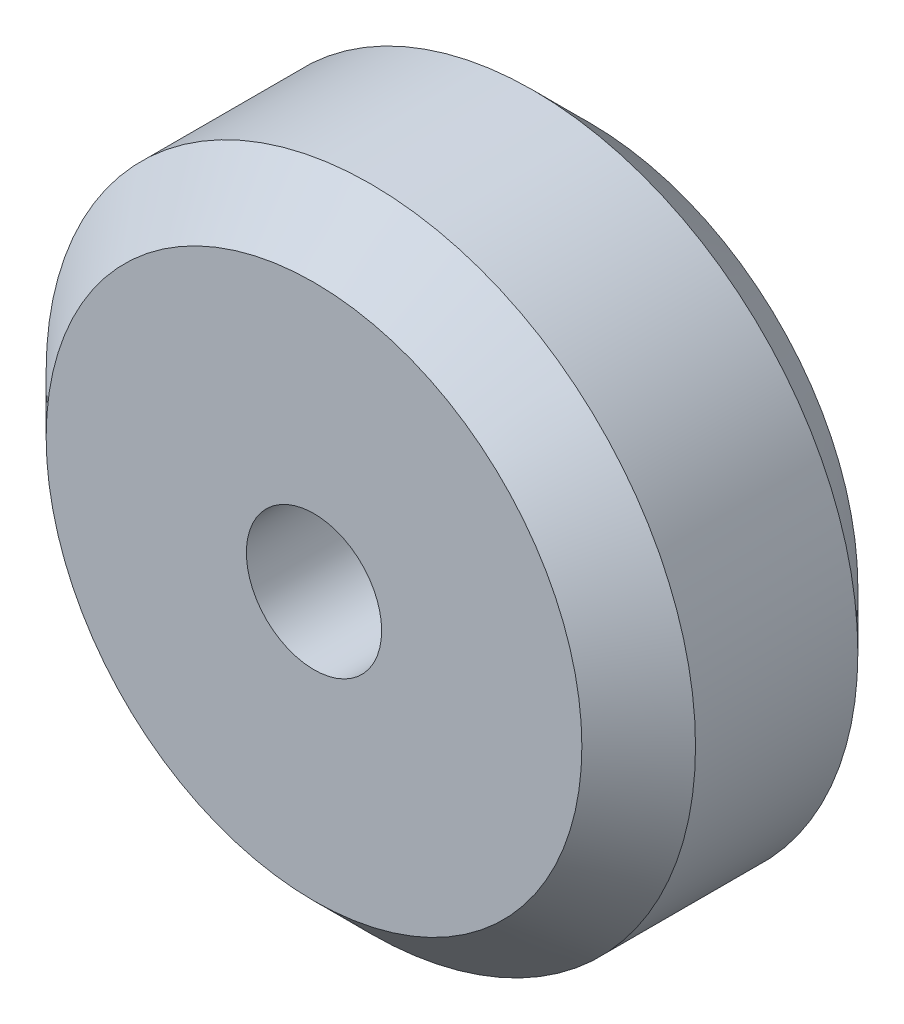
from build123d import *

# Parameters (mm, degrees)
SKETCH2_R           = 12
SKETCH2_R_2         = 2.5
BOSS_EXTRUDE1_DEPTH = 10.2
CHAMFER1_SIZE       = 2.1


with BuildPart() as part:
    # Sketch2 → Boss-Extrude1 (new body)
    with BuildSketch(Plane.XY):
        Circle(SKETCH2_R)
        Circle(SKETCH2_R_2, mode=Mode.SUBTRACT)
    extrude(amount=BOSS_EXTRUDE1_DEPTH)

    # Chamfer1
    chamfer1_edges = [part.edges().sort_by_distance(p)[0] for p in [
        (-12, 0, 0),
        (-12, 0, 10.2),
    ]]
    chamfer(chamfer1_edges, length=CHAMFER1_SIZE)


solid = part.part
